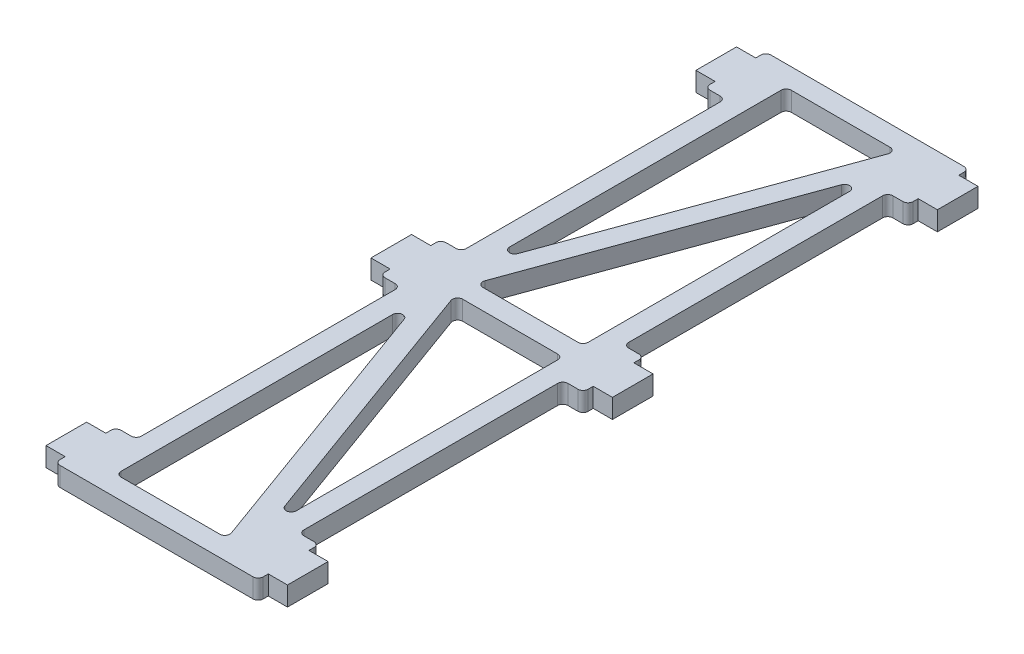
from build123d import *

# Parameters (mm, degrees)
SKETCH1_W           = 25.4
SKETCH1_H           = 111.125
BOSS_EXTRUDE1_DEPTH = 1.5
SKETCH2_W           = 3.175
SKETCH2_H           = 9.525
BOSS_EXTRUDE2_DEPTH = 3
CUT_EXTRUDE1_DEPTH  = 3
FILLET1_R           = 0.79375
SKETCH5_W           = 3
SKETCH5_H           = 6.35
BOSS_EXTRUDE3_DEPTH = 3


with BuildPart() as part:
    # Sketch1 → Boss-Extrude1 (new, symmetric)
    with BuildSketch(Plane(origin=(0, 34.29, 0), x_dir=(1, 0, 0), z_dir=(0, 1, 0))):
        with Locations((0, 120.65)):
            Rectangle(SKETCH1_W, SKETCH1_H)
    extrude(amount=BOSS_EXTRUDE1_DEPTH, both=True)

    # Sketch2 → Boss-Extrude2 (add)
    with BuildSketch(Plane(origin=(0, 35.79, 0), x_dir=(1, 0, 0), z_dir=(0, 1, 0))):
        with Locations((14.2875, 171.45)):
            Rectangle(SKETCH2_W, SKETCH2_H)
        with Locations((-14.2875, 171.45)):
            Rectangle(SKETCH2_W, SKETCH2_H)
        with Locations((14.2875, 120.65)):
            Rectangle(SKETCH2_W, SKETCH2_H)
        with Locations((-14.2875, 120.65)):
            Rectangle(SKETCH2_W, SKETCH2_H)
        with Locations((14.2875, 69.85)):
            Rectangle(SKETCH2_W, SKETCH2_H)
        with Locations((-14.2875, 69.85)):
            Rectangle(SKETCH2_W, SKETCH2_H)
    extrude(amount=-BOSS_EXTRUDE2_DEPTH)

    # Sketch4 → Cut-Extrude1 (cut)
    with BuildSketch(Plane(origin=(0, 35.79, 0), x_dir=(1, 0, 0), z_dir=(0, 1, 0))):
        Polygon((7.83579899, 173.0375), (-9.525, 173.0375), (-9.525, 125.295302777), align=None)
        Polygon((9.525, 122.2375), (9.525, 168.392197223), (-7.258526263, 122.2375), align=None)
        Polygon((9.525, 119.0625), (-7.258526263, 119.0625), (9.525, 72.907802777), align=None)
        Polygon((7.83579899, 68.2625), (-9.525, 116.004697223), (-9.525, 68.2625), align=None)
    extrude(amount=-CUT_EXTRUDE1_DEPTH, mode=Mode.SUBTRACT)

    # Fillet1
    fillet1_edges = [part.edges().sort_by_distance(p)[0] for p in [
        (-7.258526263, 34.29, -122.2375),
        (9.525, 34.29, -168.392197223),
        (9.525, 34.29, -122.2375),
        (9.525, 34.29, -72.907802777),
        (-7.258526263, 34.29, -119.0625),
        (9.525, 34.29, -119.0625),
        (7.83579899, 34.29, -68.2625),
        (-9.525, 34.29, -68.2625),
        (-9.525, 34.29, -116.004697223),
        (-9.525, 34.29, -125.295302777),
        (-9.525, 34.29, -173.0375),
        (7.83579899, 34.29, -173.0375),
        (15.875, 34.29, -65.0875),
        (15.875, 34.29, -74.6125),
        (12.7, 34.29, -74.6125),
        (-12.7, 34.29, -115.8875),
        (-12.7, 34.29, -125.4125),
        (-15.875, 34.29, -125.4125),
        (-15.875, 34.29, -115.8875),
        (15.875, 34.29, -115.8875),
        (15.875, 34.29, -125.4125),
        (12.7, 34.29, -125.4125),
        (12.7, 34.29, -115.8875),
        (-12.7, 34.29, -166.6875),
        (-15.875, 34.29, -176.2125),
        (-15.875, 34.29, -166.6875),
        (-12.7, 34.29, -74.6125),
        (-15.875, 34.29, -74.6125),
        (-15.875, 34.29, -65.0875),
        (15.875, 34.29, -166.6875),
        (15.875, 34.29, -176.2125),
        (12.7, 34.29, -166.6875),
    ]]
    fillet(fillet1_edges, radius=FILLET1_R)

    # Sketch5 → Boss-Extrude3 (add)
    with BuildSketch(Plane(origin=(0, 35.79, 0), x_dir=(1, 0, 0), z_dir=(0, 1, 0))):
        with Locations((17.375, 171.45)):
            Rectangle(SKETCH5_W, SKETCH5_H)
        with Locations((-17.375, 171.45)):
            Rectangle(SKETCH5_W, SKETCH5_H)
        with Locations((17.375, 120.65)):
            Rectangle(SKETCH5_W, SKETCH5_H)
        with Locations((-17.375, 120.65)):
            Rectangle(SKETCH5_W, SKETCH5_H)
        with Locations((17.375, 69.85)):
            Rectangle(SKETCH5_W, SKETCH5_H)
        with Locations((-17.375, 69.85)):
            Rectangle(SKETCH5_W, SKETCH5_H)
    extrude(amount=-BOSS_EXTRUDE3_DEPTH)


solid = part.part
